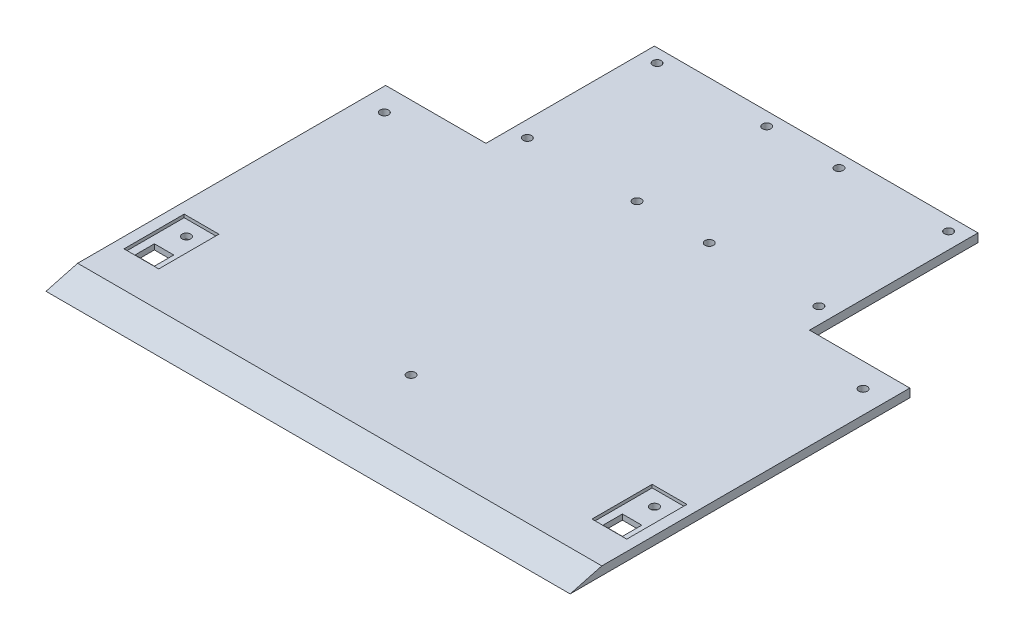
from build123d import *

# Parameters (mm, degrees)
SALIENTE_EXTRUIR1_DEPTH = 196
CORTAR_EXTRUIR1_REACH   = 274.995
CROQUIS2_W              = 37.5
CROQUIS2_H              = 62.989872981
CROQUIS3_W              = 13
CROQUIS3_H              = 22.5
CORTAR_EXTRUIR2_DEPTH   = 1.17
CORTAR_EXTRUIR3_REACH   = 274.984
CROQUIS5_W              = 7.25
CROQUIS5_H              = 7.25
CORTAR_EXTRUIR4_REACH   = 274.984
CROQUIS6_R              = 1.6
CUT_EXTRUDE1_REACH      = 274.995
SKETCH1_R               = 1.585
CUT_EXTRUDE2_REACH      = 274.995
SKETCH2_R               = 1.585
CUT_EXTRUDE3_REACH      = 274.995
SKETCH3_R               = 1.579889923
SKETCH3_R_2             = 1.585


with BuildPart() as part:
    # Croquis1 → Saliente-Extruir1 (new body)
    with BuildSketch(Plane(origin=(0, 0, 0), x_dir=(0, 0, -1), z_dir=(1, 0, 0))):
        Polygon((0, 0), (190, 0), (190, 3.17), (11.83060106, 3.17), align=None)
    extrude(amount=SALIENTE_EXTRUIR1_DEPTH)

    # Croquis2 → Cortar-Extruir1 (cut, up to next)
    with BuildSketch(Plane(origin=(0, 0, 0), x_dir=(-1, 0, 0), z_dir=(0, -1, 0)), mode=Mode.PRIVATE) as cortar_extruir1_sk1:
        with Locations((-18.75, 158.50506351)):
            Rectangle(CROQUIS2_W, CROQUIS2_H)
    cortar_extruir1_tool1 = extrude(cortar_extruir1_sk1.sketch, amount=-CORTAR_EXTRUIR1_REACH, mode=Mode.PRIVATE) & part.part
    cortar_extruir1 = cortar_extruir1_tool1.solids().sort_by_distance((18.75, 0, -158.505064))[0]
    add(cortar_extruir1, mode=Mode.SUBTRACT)

    # Simetría1: Cortar-Extruir1 across plane
    add(cortar_extruir1.mirror(Plane.ZY.offset(-98)), mode=Mode.SUBTRACT)

    # Croquis3 → Cortar-Extruir2 (cut)
    with BuildSketch(Plane(origin=(0, 3.17, 0), x_dir=(1, 0, 0), z_dir=(0, 1, 0))):
        with Locations((10.5, 36.41)):
            Rectangle(CROQUIS3_W, CROQUIS3_H)
    cortar_extruir2 = extrude(amount=-CORTAR_EXTRUIR2_DEPTH, mode=Mode.SUBTRACT)

    # Croquis5 → Cortar-Extruir3 (cut, up to next)
    with BuildSketch(Plane(origin=(0, 2, 0), x_dir=(1, 0, 0), z_dir=(0, 1, 0)), mode=Mode.PRIVATE) as cortar_extruir3_sk1:
        with Locations((10.5, 30.035)):
            Rectangle(CROQUIS5_W, CROQUIS5_H)
    cortar_extruir3_tool1 = extrude(cortar_extruir3_sk1.sketch, amount=-CORTAR_EXTRUIR3_REACH, mode=Mode.PRIVATE) & part.part
    cortar_extruir3 = cortar_extruir3_tool1.solids().sort_by_distance((10.5, 2, -30.035))[0]
    add(cortar_extruir3, mode=Mode.SUBTRACT)

    # Croquis6 → Cortar-Extruir4 (cut, up to next)
    with BuildSketch(Plane(origin=(0, 2, 0), x_dir=(1, 0, 0), z_dir=(0, 1, 0)), mode=Mode.PRIVATE) as cortar_extruir4_sk1:
        with Locations(Location((10.5, 42.01, 0), (0, 0, 270))):
            Circle(CROQUIS6_R)
    cortar_extruir4_tool1 = extrude(cortar_extruir4_sk1.sketch, amount=-CORTAR_EXTRUIR4_REACH, mode=Mode.PRIVATE) & part.part
    cortar_extruir4 = cortar_extruir4_tool1.solids().sort_by_distance((10.5, 2, -42.01))[0]
    add(cortar_extruir4, mode=Mode.SUBTRACT)

    # Simetría2: Cortar-Extruir2, Cortar-Extruir3, Cortar-Extruir4 across plane
    add(cortar_extruir2.mirror(Plane.ZY.offset(-98)), mode=Mode.SUBTRACT)
    add(cortar_extruir3.mirror(Plane.ZY.offset(-98)), mode=Mode.SUBTRACT)
    add(cortar_extruir4.mirror(Plane.ZY.offset(-98)), mode=Mode.SUBTRACT)

    # Sketch1 → Cut-Extrude1 (cut, up to next)
    with BuildSketch(Plane(origin=(0, 3.17, 0), x_dir=(1, 0, 0), z_dir=(0, 1, 0)), mode=Mode.PRIVATE) as cut_extrude1_sk1:
        with Locations(Location((8.5, 118.010127019, 0), (0, 0, 270))):
            Circle(SKETCH1_R)
    cut_extrude1_tool1 = extrude(cut_extrude1_sk1.sketch, amount=-CUT_EXTRUDE1_REACH, mode=Mode.PRIVATE) & part.part
    # Sketch1 → Cut-Extrude1 (cut, up to next)
    with BuildSketch(Plane(origin=(0, 3.17, 0), x_dir=(1, 0, 0), z_dir=(0, 1, 0)), mode=Mode.PRIVATE) as cut_extrude1_sk2:
        with Locations(Location((187.5, 118.010127019, 0), (0, 0, 270))):
            Circle(SKETCH1_R)
    cut_extrude1_tool2 = extrude(cut_extrude1_sk2.sketch, amount=-CUT_EXTRUDE1_REACH, mode=Mode.PRIVATE) & part.part
    add(cut_extrude1_tool1.solids().sort_by_distance((8.5, 3.17, -118.010127))[0], mode=Mode.SUBTRACT)
    add(cut_extrude1_tool2.solids().sort_by_distance((187.5, 3.17, -118.010127))[0], mode=Mode.SUBTRACT)

    # Sketch2 → Cut-Extrude2 (cut, up to next)
    with BuildSketch(Plane(origin=(0, 3.17, 0), x_dir=(1, 0, 0), z_dir=(0, 1, 0)), mode=Mode.PRIVATE) as cut_extrude2_sk1:
        with Locations(Location((98.5, 38.010127019, 0), (0, 0, 270))):
            Circle(SKETCH2_R)
    cut_extrude2_tool1 = extrude(cut_extrude2_sk1.sketch, amount=-CUT_EXTRUDE2_REACH, mode=Mode.PRIVATE) & part.part
    add(cut_extrude2_tool1.solids().sort_by_distance((98.5, 3.17, -38.010127))[0], mode=Mode.SUBTRACT)

    # Sketch3 → Cut-Extrude3 (cut, up to next)
    with BuildSketch(Plane(origin=(0, 3.17, 0), x_dir=(1, 0, 0), z_dir=(0, 1, 0)), mode=Mode.PRIVATE) as cut_extrude3_sk1:
        with Locations(Location((43.5, 185, 0), (0, 0, 270))):
            Circle(SKETCH3_R)
    cut_extrude3_tool1 = extrude(cut_extrude3_sk1.sketch, amount=-CUT_EXTRUDE3_REACH, mode=Mode.PRIVATE) & part.part
    # Sketch3 → Cut-Extrude3 (cut, up to next)
    with BuildSketch(Plane(origin=(0, 3.17, 0), x_dir=(1, 0, 0), z_dir=(0, 1, 0)), mode=Mode.PRIVATE) as cut_extrude3_sk2:
        with Locations(Location((84.5, 185, 0), (0, 0, 270))):
            Circle(SKETCH3_R_2)
    cut_extrude3_tool2 = extrude(cut_extrude3_sk2.sketch, amount=-CUT_EXTRUDE3_REACH, mode=Mode.PRIVATE) & part.part
    # Sketch3 → Cut-Extrude3 (cut, up to next)
    with BuildSketch(Plane(origin=(0, 3.17, 0), x_dir=(1, 0, 0), z_dir=(0, 1, 0)), mode=Mode.PRIVATE) as cut_extrude3_sk3:
        with Locations(Location((152.5, 185, 0), (0, 0, 270))):
            Circle(SKETCH3_R_2)
    cut_extrude3_tool3 = extrude(cut_extrude3_sk3.sketch, amount=-CUT_EXTRUDE3_REACH, mode=Mode.PRIVATE) & part.part
    # Sketch3 → Cut-Extrude3 (cut, up to next)
    with BuildSketch(Plane(origin=(0, 3.17, 0), x_dir=(1, 0, 0), z_dir=(0, 1, 0)), mode=Mode.PRIVATE) as cut_extrude3_sk4:
        with Locations(Location((111.5, 185, 0), (0, 0, 270))):
            Circle(SKETCH3_R_2)
    cut_extrude3_tool4 = extrude(cut_extrude3_sk4.sketch, amount=-CUT_EXTRUDE3_REACH, mode=Mode.PRIVATE) & part.part
    # Sketch3 → Cut-Extrude3 (cut, up to next)
    with BuildSketch(Plane(origin=(0, 3.17, 0), x_dir=(1, 0, 0), z_dir=(0, 1, 0)), mode=Mode.PRIVATE) as cut_extrude3_sk5:
        with Locations(Location((111.5, 136.5, 0), (0, 0, 270))):
            Circle(SKETCH3_R_2)
    cut_extrude3_tool5 = extrude(cut_extrude3_sk5.sketch, amount=-CUT_EXTRUDE3_REACH, mode=Mode.PRIVATE) & part.part
    # Sketch3 → Cut-Extrude3 (cut, up to next)
    with BuildSketch(Plane(origin=(0, 3.17, 0), x_dir=(1, 0, 0), z_dir=(0, 1, 0)), mode=Mode.PRIVATE) as cut_extrude3_sk6:
        with Locations(Location((152.5, 136.5, 0), (0, 0, 270))):
            Circle(SKETCH3_R_2)
    cut_extrude3_tool6 = extrude(cut_extrude3_sk6.sketch, amount=-CUT_EXTRUDE3_REACH, mode=Mode.PRIVATE) & part.part
    # Sketch3 → Cut-Extrude3 (cut, up to next)
    with BuildSketch(Plane(origin=(0, 3.17, 0), x_dir=(1, 0, 0), z_dir=(0, 1, 0)), mode=Mode.PRIVATE) as cut_extrude3_sk7:
        with Locations(Location((84.5, 136.5, 0), (0, 0, 270))):
            Circle(SKETCH3_R_2)
    cut_extrude3_tool7 = extrude(cut_extrude3_sk7.sketch, amount=-CUT_EXTRUDE3_REACH, mode=Mode.PRIVATE) & part.part
    # Sketch3 → Cut-Extrude3 (cut, up to next)
    with BuildSketch(Plane(origin=(0, 3.17, 0), x_dir=(1, 0, 0), z_dir=(0, 1, 0)), mode=Mode.PRIVATE) as cut_extrude3_sk8:
        with Locations(Location((43.5, 136.5, 0), (0, 0, 270))):
            Circle(SKETCH3_R_2)
    cut_extrude3_tool8 = extrude(cut_extrude3_sk8.sketch, amount=-CUT_EXTRUDE3_REACH, mode=Mode.PRIVATE) & part.part
    add(cut_extrude3_tool1.solids().sort_by_distance((43.5, 3.17, -185))[0], mode=Mode.SUBTRACT)
    add(cut_extrude3_tool2.solids().sort_by_distance((84.5, 3.17, -185))[0], mode=Mode.SUBTRACT)
    add(cut_extrude3_tool3.solids().sort_by_distance((152.5, 3.17, -185))[0], mode=Mode.SUBTRACT)
    add(cut_extrude3_tool4.solids().sort_by_distance((111.5, 3.17, -185))[0], mode=Mode.SUBTRACT)
    add(cut_extrude3_tool5.solids().sort_by_distance((111.5, 3.17, -136.5))[0], mode=Mode.SUBTRACT)
    add(cut_extrude3_tool6.solids().sort_by_distance((152.5, 3.17, -136.5))[0], mode=Mode.SUBTRACT)
    add(cut_extrude3_tool7.solids().sort_by_distance((84.5, 3.17, -136.5))[0], mode=Mode.SUBTRACT)
    add(cut_extrude3_tool8.solids().sort_by_distance((43.5, 3.17, -136.5))[0], mode=Mode.SUBTRACT)


solid = part.part
